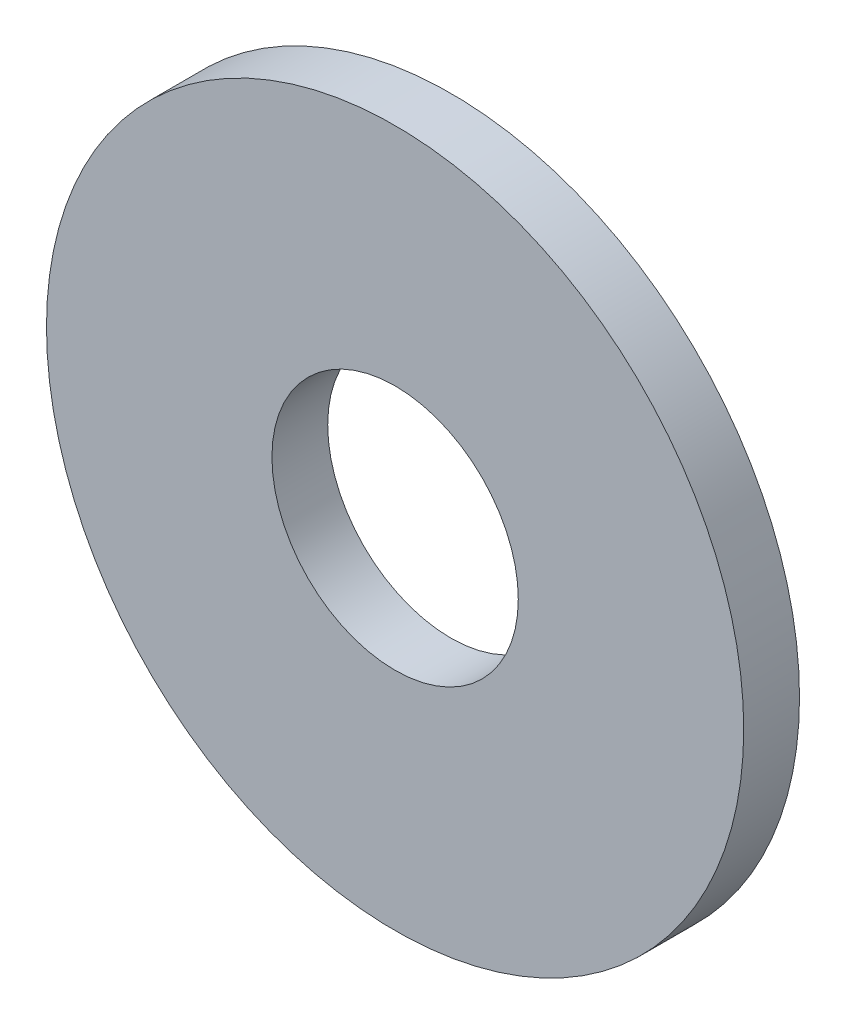
from build123d import *

# Parameters (mm, degrees)
SKETCH_1_W = 1.2
SKETCH_1_H = 4.85


with BuildPart() as part:
    # 草图1 → 旋转1 (revolve)
    with BuildSketch(Plane(origin=(0, 0, 0), x_dir=(0, 0, -1), z_dir=(1, 0, 0)), mode=Mode.PRIVATE) as revolve_1_sk:
        with Locations((0.6, 5.075)):
            Rectangle(SKETCH_1_W, SKETCH_1_H)
    revolve(revolve_1_sk.sketch.rotate(Axis((0, 0, 5), (0, 0, -1)), 90), axis=Axis((0, 0, 5), (0, 0, -1)))


solid = part.part
